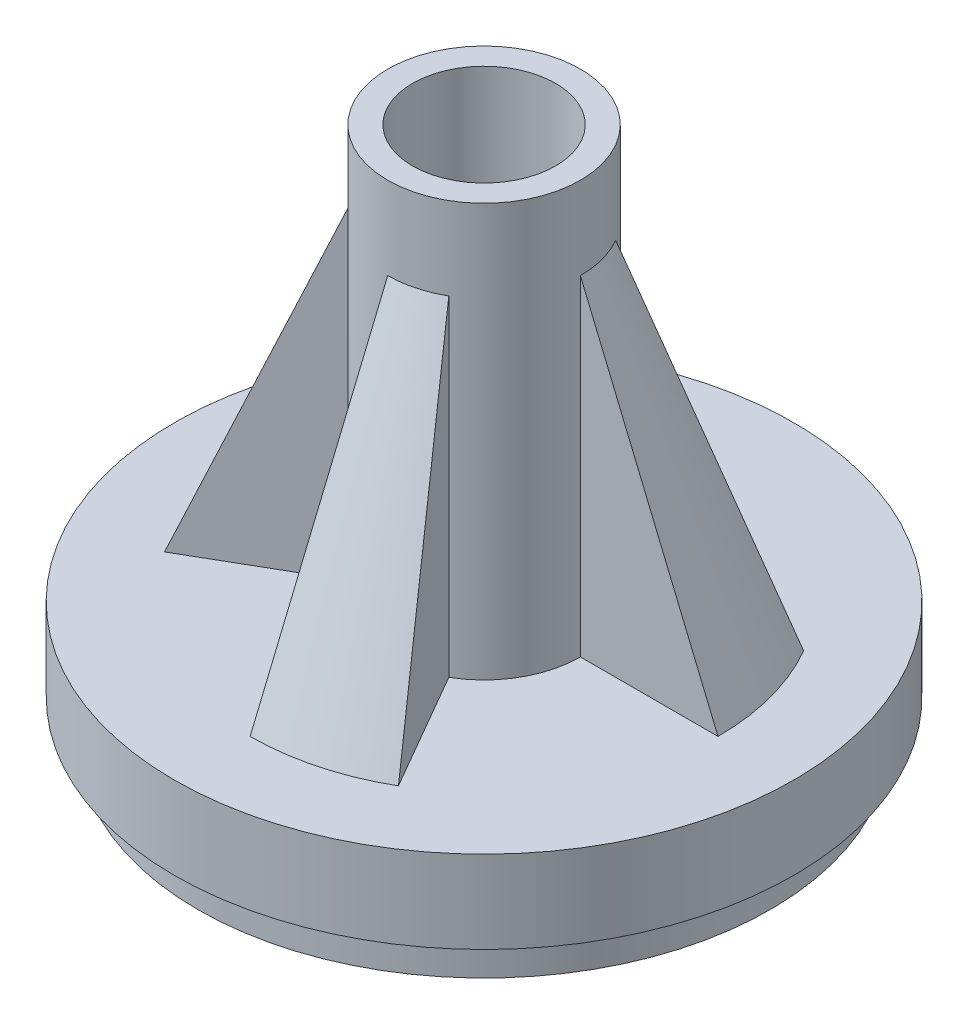
from build123d import *

# Parameters (mm, degrees)
SKETCH_1_R          = 10.4
EXTRUDE_1_DEPTH     = 1.5
SKETCH_2_R          = 11.25
EXTRUDE_2_DEPTH     = 3
SKETCH_3_R          = 3.5
SKETCH_3_R_2        = 2.6
EXTRUDE_3_DEPTH     = 15
SKETCH_3_4_R        = 1.1
CUT_EXTRUDE_2_DEPTH = 4.5
REVOLVE_3_ANGLE     = 30
REVOLVE_4_ANGLE     = 30


with BuildPart() as part:
    # 草图1 → 凸台-拉伸1 (new body)
    with BuildSketch(Plane(origin=(0, 0, 0), x_dir=(1, 0, 0), z_dir=(0, 1, 0))):
        with Locations(Location((0, 0, 0), (0, 0, 270))):
            Circle(SKETCH_1_R)
    extrude(amount=EXTRUDE_1_DEPTH)

    # 草图2 → 凸台-拉伸2 (add)
    with BuildSketch(Plane(origin=(0, 1.5, 0), x_dir=(1, 0, 0), z_dir=(0, 1, 0))):
        with Locations(Location((0, 0, 0), (0, 0, 270))):
            Circle(SKETCH_2_R)
    extrude(amount=EXTRUDE_2_DEPTH)

    # 草图3 → 凸台-拉伸3 (add)
    with BuildSketch(Plane(origin=(0, 4.5, 0), x_dir=(1, 0, 0), z_dir=(0, 1, 0))):
        with Locations(Location((0, 0, 0), (0, 0, 270))):
            Circle(SKETCH_3_R)
        with Locations(Location((0, 0, 0), (0, 0, 270))):
            Circle(SKETCH_3_R_2, mode=Mode.SUBTRACT)
    extrude(amount=EXTRUDE_3_DEPTH)

    # 草图3<4> → 切除-拉伸2 (cut)
    with BuildSketch(Plane(origin=(0, 4.5, 0), x_dir=(1, 0, 0), z_dir=(0, 1, 0))):
        with Locations(Location((0, 0, 0), (0, 0, 270))):
            Circle(SKETCH_3_4_R)
    extrude(amount=-CUT_EXTRUDE_2_DEPTH, mode=Mode.SUBTRACT)

    # 草图6 → 旋转3 (revolve)
    with BuildSketch(Plane(origin=(0, 0, 0), x_dir=(0, 0, -1), z_dir=(1, 0, 0))):
        Polygon((3.5, 4.5), (3.5, 16.5), (8.5, 4.5), align=None)
        Polygon((-8.5, 4.5), (-3.5, 4.5), (-3.5, 16.5), align=None)
    revolve(axis=Axis((0, 0, 0), (0, 1, 0)), revolution_arc=REVOLVE_3_ANGLE)

    # 草图9 → 旋转4 (revolve)
    with BuildSketch(Plane.XY):
        Polygon((3.5, 4.5), (8.5, 4.5), (3.5, 16.5), align=None)
        Polygon((-8.5, 4.5), (-3.5, 16.5), (-3.5, 4.5), align=None)
    revolve(axis=Axis((0, 0, 0), (0, 1, 0)), revolution_arc=REVOLVE_4_ANGLE)


solid = part.part
